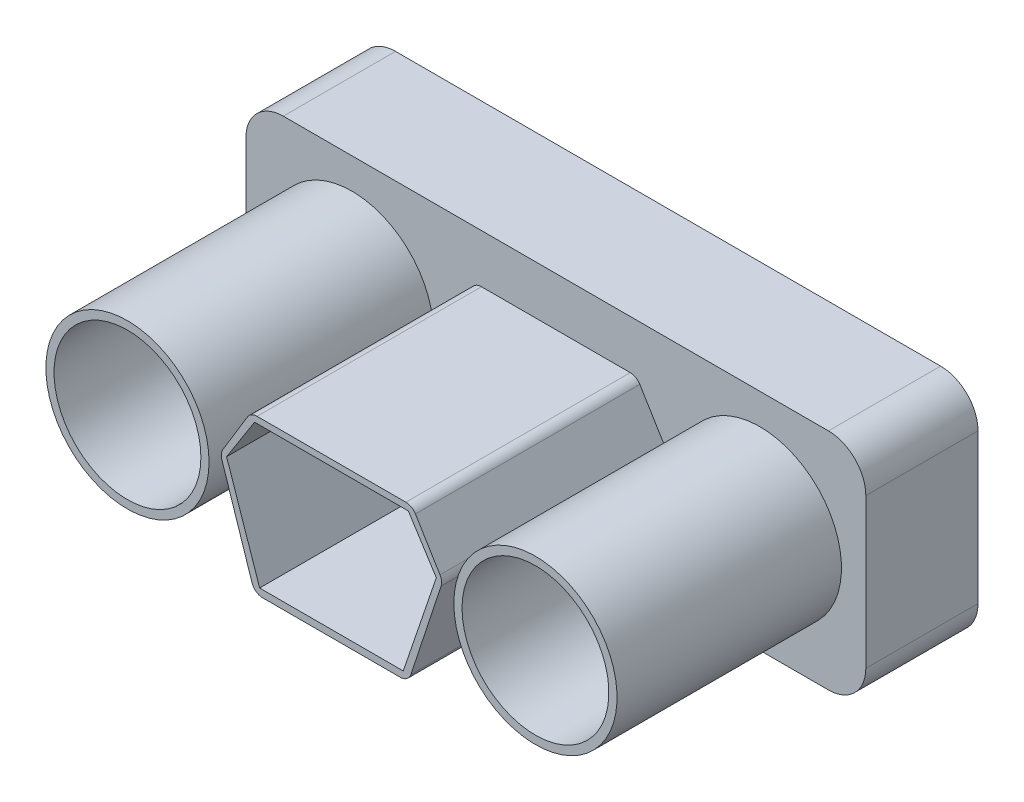
from build123d import *

# Parameters (mm, degrees)
SKETCH1_W           = 16.57424281
SKETCH1_H           = 6
BOSS_EXTRUDE1_DEPTH = 3
SKETCH2_R           = 2.181797835
SKETCH2_R_2         = 1.963463841
BOSS_EXTRUDE2_DEPTH = 6
FILLET2_R           = 1
FILLET3_R           = 0.3


with BuildPart() as part:
    # Sketch1 → Boss-Extrude1 (new body)
    with BuildSketch(Plane.XY):
        Rectangle(SKETCH1_W, SKETCH1_H)
    extrude(amount=BOSS_EXTRUDE1_DEPTH)

    # Sketch2 → Boss-Extrude2 (add)
    # profile 1 of 3: a face of its own
    with BuildSketch(Plane.XY.offset(3)):
        with Locations((-5.454256394, 0)):
            Circle(SKETCH2_R)
        with Locations((-5.454256394, 0)):
            Circle(SKETCH2_R_2, mode=Mode.SUBTRACT)
    # profile 2 of 3: a face of its own
    with BuildSketch(Plane.XY.offset(3)):
        with Locations(Location((5.454256394, 0, 0), (0, 0, 180))):
            Circle(SKETCH2_R)
        with Locations(Location((5.454256394, 0, 0), (0, 0, 180))):
            Circle(SKETCH2_R_2, mode=Mode.SUBTRACT)
    # profile 3 of 3: a face of its own
    with BuildSketch(Plane.XY.offset(3)):
        Polygon((-2.055965806, -2.429777771), (2.055965806, -2.429777771), (2.973504265, 0.356820512), (2.157914524, 1.699145294), (-2.157914524, 1.699145294), (-2.973504265, 0.356820512), align=None)
        Polygon((-1.920034182, -2.242871788), (1.920034182, -2.242871788), (2.803589735, 0.356820512), (2.055965806, 1.529230765), (-2.055965806, 1.529230765), (-2.803589735, 0.356820512), align=None, mode=Mode.SUBTRACT)
    extrude(amount=BOSS_EXTRUDE2_DEPTH)

    # Fillet2
    fillet2_edges = [part.edges().sort_by_distance(p)[0] for p in [
        (8.287121405, -3, 1.5),
        (-8.287121405, -3, 1.5),
        (-8.287121405, 3, 1.5),
        (8.287121405, 3, 1.5),
    ]]
    fillet(fillet2_edges, radius=FILLET2_R)

    # Fillet3
    fillet3_edges = [part.edges().sort_by_distance(p)[0] for p in [
        (-2.157914524, 1.699145294, 6),
        (-2.973504265, 0.356820512, 6),
        (-2.055965806, -2.429777771, 6),
        (2.055965806, -2.429777771, 6),
        (2.973504265, 0.356820512, 6),
        (2.157914524, 1.699145294, 6),
    ]]
    fillet(fillet3_edges, radius=FILLET3_R)


solid = part.part
